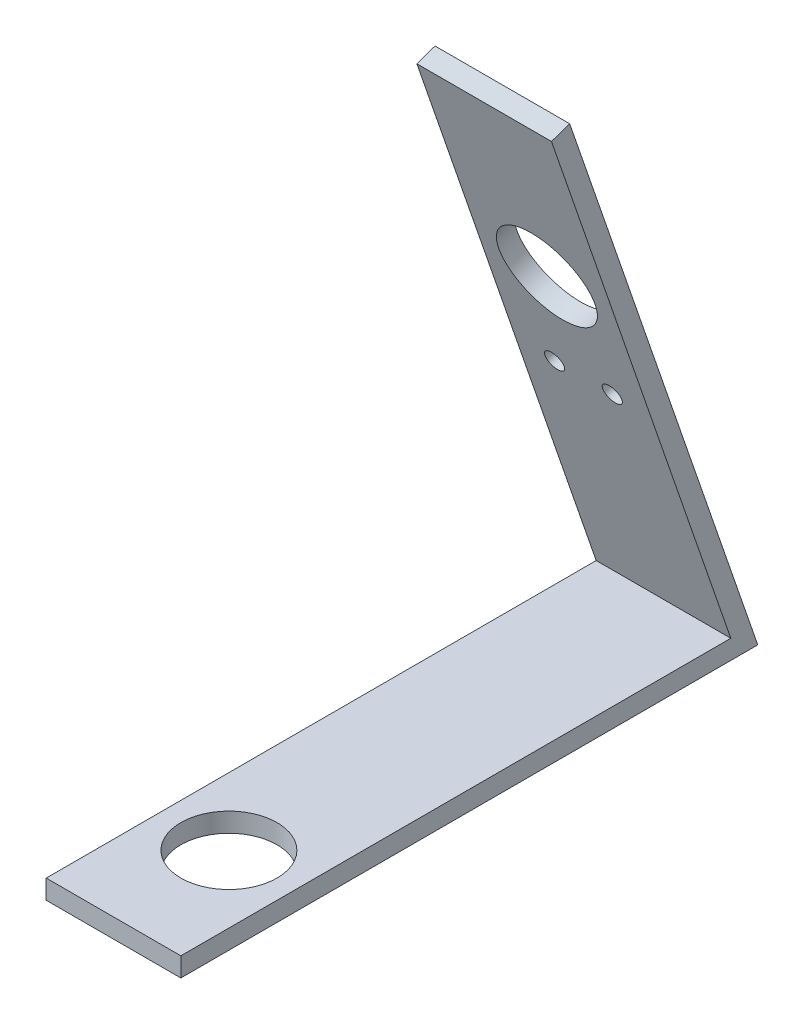
from build123d import *

# Parameters (mm, degrees)
BOSS_EXTRUDE1_DEPTH = 70
SKETCH2_R           = 25
CUT_EXTRUDE1_DEPTH  = 10
SKETCH5_R           = 25
CUT_EXTRUDE3_DEPTH  = 300
SKETCH6_R           = 5
CUT_EXTRUDE5_DEPTH  = 10


with BuildPart() as part:
    # Sketch1 → Boss-Extrude1 (new body)
    with BuildSketch(Plane(origin=(0, 0, 0), x_dir=(0, 0, -1), z_dir=(1, 0, 0))):
        Polygon((-93.245185093, 270.343761851), (0, 0), (-285.972750651, 0), (-285.972750651, -10), (14.027249349, -10), (-83.791705303, 273.604393673), align=None)
    extrude(amount=BOSS_EXTRUDE1_DEPTH)

    # Sketch2 → Cut-Extrude1 (cut)
    with BuildSketch(Plane(origin=(0, 3.260631822, -9.453479789), x_dir=(1, 0, 0), z_dir=(0, 0.3260631821748509, -0.945347978910417))):
        with Locations(Location((35, -185.972750651, 0), (0, 0, 270))):
            Circle(SKETCH2_R)
    extrude(amount=-CUT_EXTRUDE1_DEPTH, mode=Mode.SUBTRACT)

    # Sketch5 → Cut-Extrude3 (cut)
    with BuildSketch(Plane(origin=(0, 0, 0), x_dir=(1, 0, 0), z_dir=(0, 1, 0))):
        with Locations(Location((35, -225.972750651, 0), (0, 0, 270))):
            Circle(SKETCH5_R)
    extrude(amount=-CUT_EXTRUDE3_DEPTH, mode=Mode.SUBTRACT)

    # Sketch6 → Cut-Extrude5 (cut)
    with BuildSketch(Plane(origin=(0, 3.260631822, -9.453479789), x_dir=(1, 0, 0), z_dir=(0, 0.326063182174851, -0.945347978910417))):
        with Locations((50, -197.679491924)):
            Circle(SKETCH6_R)
        with Locations((20, -197.679491924)):
            Circle(SKETCH6_R)
        with Locations(Location((20, -127.679491924, 0), (0, 0, 270))):
            Circle(SKETCH6_R)
        with Locations(Location((50, -127.679491924, 0), (0, 0, 270))):
            Circle(SKETCH6_R)
    extrude(amount=-CUT_EXTRUDE5_DEPTH, mode=Mode.SUBTRACT)


solid = part.part
